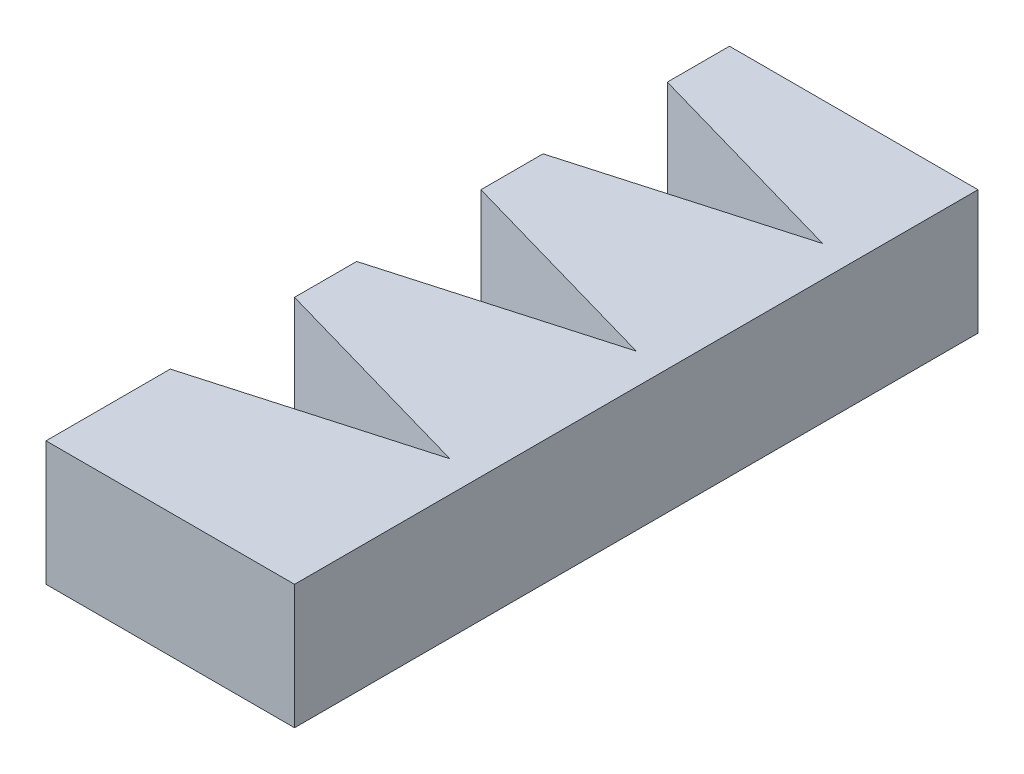
from build123d import *

# Parameters (mm, degrees)
BOSS_EXTRUDE1_DEPTH = 20


with BuildPart() as part:
    # Sketch1 → Boss-Extrude1 (new body)
    with BuildSketch(Plane(origin=(0, 0, 0), x_dir=(1, 0, 0), z_dir=(0, 1, 0))):
        Polygon((0, 100), (0, 110), (35, 110), (40, 110), (40, 0), (0, 0), (0, 20), (35, 30), (0, 40), (0, 50), (35, 60), (0, 70), (0, 80), (35, 90), align=None)
    extrude(amount=BOSS_EXTRUDE1_DEPTH)


solid = part.part
